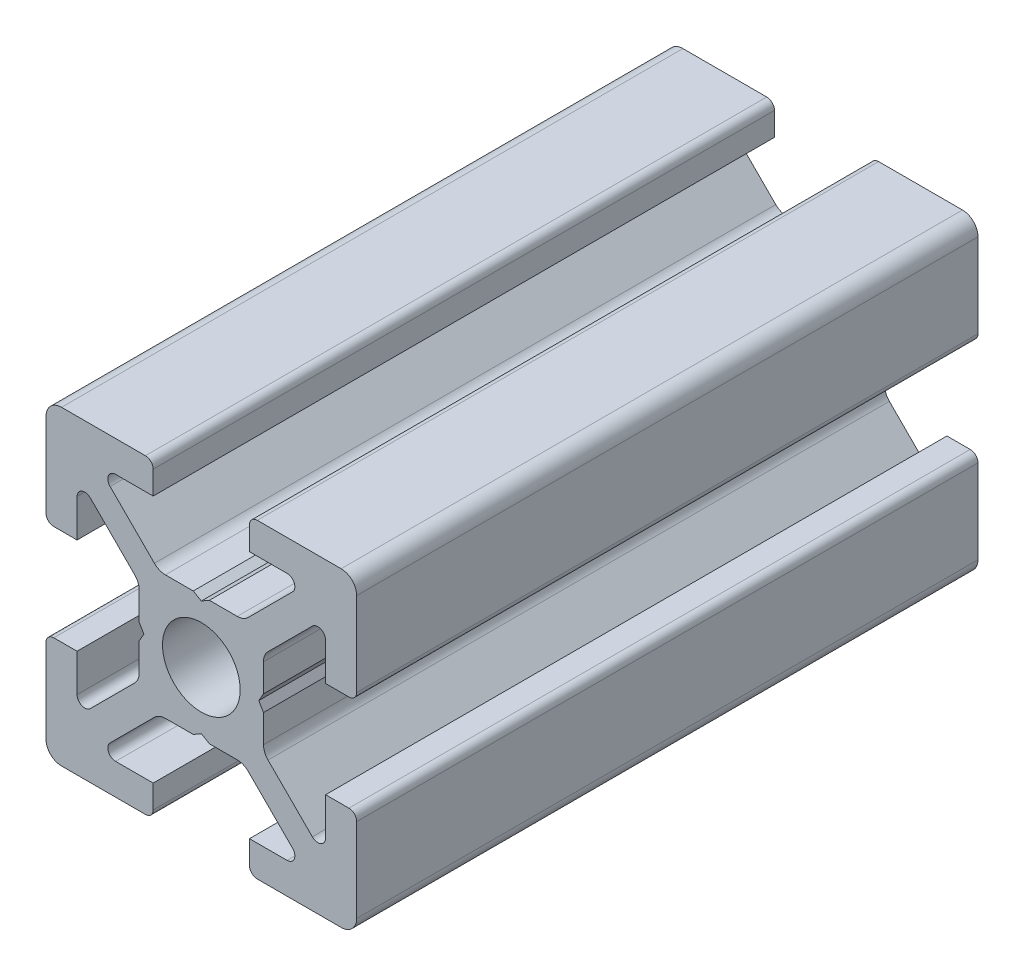
from build123d import *

# Parameters (mm, degrees)
SKETCH_1_R      = 2.5
EXTRUDE_1_DEPTH = 40


with BuildPart() as part:
    # 草图1 → 凸台-拉伸1 (new body)
    with BuildSketch(Plane.XY):
        with BuildLine():
            Line((16.486773435, 27.123343944), (19.340326826, 24.269790554))
            ThreePointArc((19.340326826, 24.269790554), (19.885221932, 24.161404178), (20.193880216, 24.623343944))
            Line((20.193880216, 24.623343944), (20.193880216, 27.043444957))
            Line((20.193880216, 27.043444957), (21.693880216, 27.043444957))
            ThreePointArc((21.693880216, 27.043444957), (22.047433607, 26.896998348), (22.193880216, 26.543444957))
            Line((22.193880216, 26.543444957), (22.193880216, 21.143444957))
            ThreePointArc((22.193880216, 21.143444957), (21.900986997, 20.436338176), (21.193880216, 20.143444957))
            Line((21.193880216, 20.143444957), (15.793880216, 20.143444957))
            ThreePointArc((15.793880216, 20.143444957), (15.440326826, 20.289891566), (15.293880216, 20.643444957))
            Line((15.293880216, 20.643444957), (15.293880216, 22.143444957))
            Line((15.293880216, 22.143444957), (17.713981229, 22.143444957))
            ThreePointArc((17.713981229, 22.143444957), (18.175920995, 22.452103241), (18.06753462, 22.996998348))
            Line((18.06753462, 22.996998348), (15.213981229, 25.850551738))
            ThreePointArc((15.213981229, 25.850551738), (14.88955788, 26.06732449), (14.506874448, 26.143444957))
            Line((14.506874448, 26.143444957), (12.713495459, 26.143444957))
            Line((12.713495459, 26.143444957), (12.193880216, 26.443444957))
            Line((12.193880216, 26.443444957), (11.674264974, 26.143444957))
            Line((11.674264974, 26.143444957), (9.880885985, 26.143444957))
            ThreePointArc((9.880885985, 26.143444957), (9.498202552, 26.06732449), (9.173779204, 25.850551738))
            Line((9.173779204, 25.850551738), (6.320225813, 22.996998348))
            ThreePointArc((6.320225813, 22.996998348), (6.211839437, 22.452103241), (6.673779204, 22.143444957))
            Line((6.673779204, 22.143444957), (9.093880216, 22.143444957))
            Line((9.093880216, 22.143444957), (9.093880216, 20.643444957))
            ThreePointArc((9.093880216, 20.643444957), (8.947433607, 20.289891566), (8.593880216, 20.143444957))
            Line((8.593880216, 20.143444957), (3.193880216, 20.143444957))
            ThreePointArc((3.193880216, 20.143444957), (2.486773435, 20.436338176), (2.193880216, 21.143444957))
            Line((2.193880216, 21.143444957), (2.193880216, 26.543444957))
            ThreePointArc((2.193880216, 26.543444957), (2.340326826, 26.896998348), (2.693880216, 27.043444957))
            Line((2.693880216, 27.043444957), (4.193880216, 27.043444957))
            Line((4.193880216, 27.043444957), (4.193880216, 24.623343944))
            ThreePointArc((4.193880216, 24.623343944), (4.5025385, 24.161404178), (5.047433607, 24.269790554))
            Line((5.047433607, 24.269790554), (7.900986997, 27.123343944))
            ThreePointArc((7.900986997, 27.123343944), (8.117759749, 27.447767293), (8.193880216, 27.830450726))
            Line((8.193880216, 27.830450726), (8.193880216, 29.623829715))
            Line((8.193880216, 29.623829715), (8.493880216, 30.143444957))
            Line((8.493880216, 30.143444957), (8.193880216, 30.663060199))
            Line((8.193880216, 30.663060199), (8.193880216, 32.456439189))
            ThreePointArc((8.193880216, 32.456439189), (8.117759749, 32.839122621), (7.900986997, 33.16354597))
            Line((7.900986997, 33.16354597), (5.047433607, 36.01709936))
            ThreePointArc((5.047433607, 36.01709936), (4.5025385, 36.125485736), (4.193880216, 35.66354597))
            Line((4.193880216, 35.66354597), (4.193880216, 33.243444957))
            Line((4.193880216, 33.243444957), (2.693880216, 33.243444957))
            ThreePointArc((2.693880216, 33.243444957), (2.340326826, 33.389891566), (2.193880216, 33.743444957))
            Line((2.193880216, 33.743444957), (2.193880216, 39.143444957))
            ThreePointArc((2.193880216, 39.143444957), (2.486773435, 39.850551738), (3.193880216, 40.143444957))
            Line((3.193880216, 40.143444957), (8.593880216, 40.143444957))
            ThreePointArc((8.593880216, 40.143444957), (8.947433607, 39.996998348), (9.093880216, 39.643444957))
            Line((9.093880216, 39.643444957), (9.093880216, 38.143444957))
            Line((9.093880216, 38.143444957), (6.673779204, 38.143444957))
            ThreePointArc((6.673779204, 38.143444957), (6.211839437, 37.834786673), (6.320225813, 37.289891566))
            Line((6.320225813, 37.289891566), (9.173779204, 34.436338176))
            ThreePointArc((9.173779204, 34.436338176), (9.498202552, 34.219565425), (9.880885985, 34.143444957))
            Line((9.880885985, 34.143444957), (11.674264974, 34.143444957))
            Line((11.674264974, 34.143444957), (12.193880216, 33.843444957))
            Line((12.193880216, 33.843444957), (12.713495459, 34.143444957))
            Line((12.713495459, 34.143444957), (14.506874448, 34.143444957))
            ThreePointArc((14.506874448, 34.143444957), (14.88955788, 34.219565425), (15.213981229, 34.436338176))
            Line((15.213981229, 34.436338176), (18.06753462, 37.289891566))
            ThreePointArc((18.06753462, 37.289891566), (18.175920995, 37.834786673), (17.713981229, 38.143444957))
            Line((17.713981229, 38.143444957), (15.293880216, 38.143444957))
            Line((15.293880216, 38.143444957), (15.293880216, 39.643444957))
            ThreePointArc((15.293880216, 39.643444957), (15.440326826, 39.996998348), (15.793880216, 40.143444957))
            Line((15.793880216, 40.143444957), (21.193880216, 40.143444957))
            ThreePointArc((21.193880216, 40.143444957), (21.900986997, 39.850551738), (22.193880216, 39.143444957))
            Line((22.193880216, 39.143444957), (22.193880216, 33.743444957))
            ThreePointArc((22.193880216, 33.743444957), (22.047433607, 33.389891566), (21.693880216, 33.243444957))
            Line((21.693880216, 33.243444957), (20.193880216, 33.243444957))
            Line((20.193880216, 33.243444957), (20.193880216, 35.66354597))
            ThreePointArc((20.193880216, 35.66354597), (19.885221932, 36.125485736), (19.340326826, 36.01709936))
            Line((19.340326826, 36.01709936), (16.486773435, 33.16354597))
            ThreePointArc((16.486773435, 33.16354597), (16.270000684, 32.839122621), (16.193880216, 32.456439189))
            Line((16.193880216, 32.456439189), (16.193880216, 30.663060199))
            Line((16.193880216, 30.663060199), (15.893880216, 30.143444957))
            Line((15.893880216, 30.143444957), (16.193880216, 29.623829715))
            Line((16.193880216, 29.623829715), (16.193880216, 27.830450726))
            ThreePointArc((16.193880216, 27.830450726), (16.270000684, 27.447767293), (16.486773435, 27.123343944))
        make_face()
        with Locations((12.193880216, 30.143444957)):
            Circle(SKETCH_1_R, mode=Mode.SUBTRACT)
    extrude(amount=EXTRUDE_1_DEPTH)


solid = part.part
